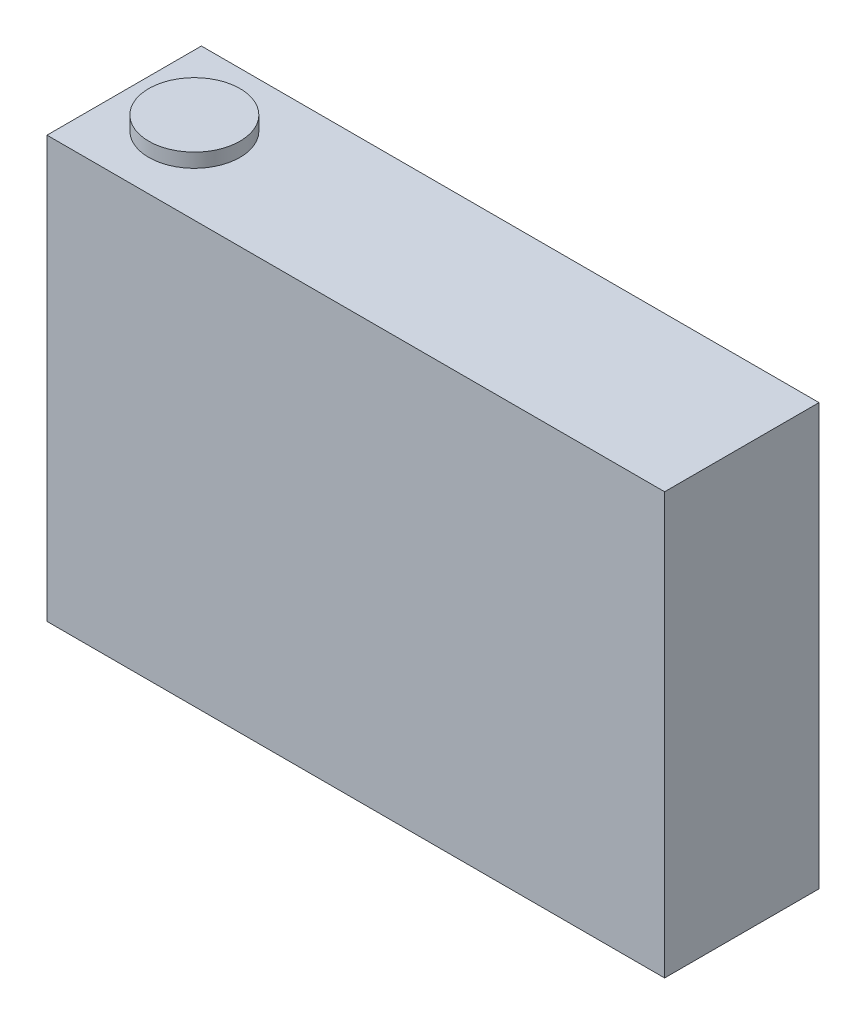
from build123d import *

# Parameters (mm, degrees)
SKETCH1_W           = 88
SKETCH1_H           = 22
SKETCH1_R           = 6.5
BOSS_EXTRUDE1_DEPTH = 60
SKETCH1_3_R         = 6.5
BOSS_EXTRUDE2_DEPTH = 62


with BuildPart() as part:
    # Sketch1 → Boss-Extrude1 (new body)
    with BuildSketch(Plane(origin=(0, 0, 0), x_dir=(1, 0, 0), z_dir=(0, 1, 0))):
        Rectangle(SKETCH1_W, SKETCH1_H)
        with Locations((-34, 0)):
            Circle(SKETCH1_R, mode=Mode.SUBTRACT)
    extrude(amount=BOSS_EXTRUDE1_DEPTH)

    # Sketch1<3> → Boss-Extrude2 (add)
    with BuildSketch(Plane(origin=(0, 0, 0), x_dir=(1, 0, 0), z_dir=(0, 1, 0))):
        with Locations((-34, 0)):
            Circle(SKETCH1_3_R)
    extrude(amount=BOSS_EXTRUDE2_DEPTH)


solid = part.part
